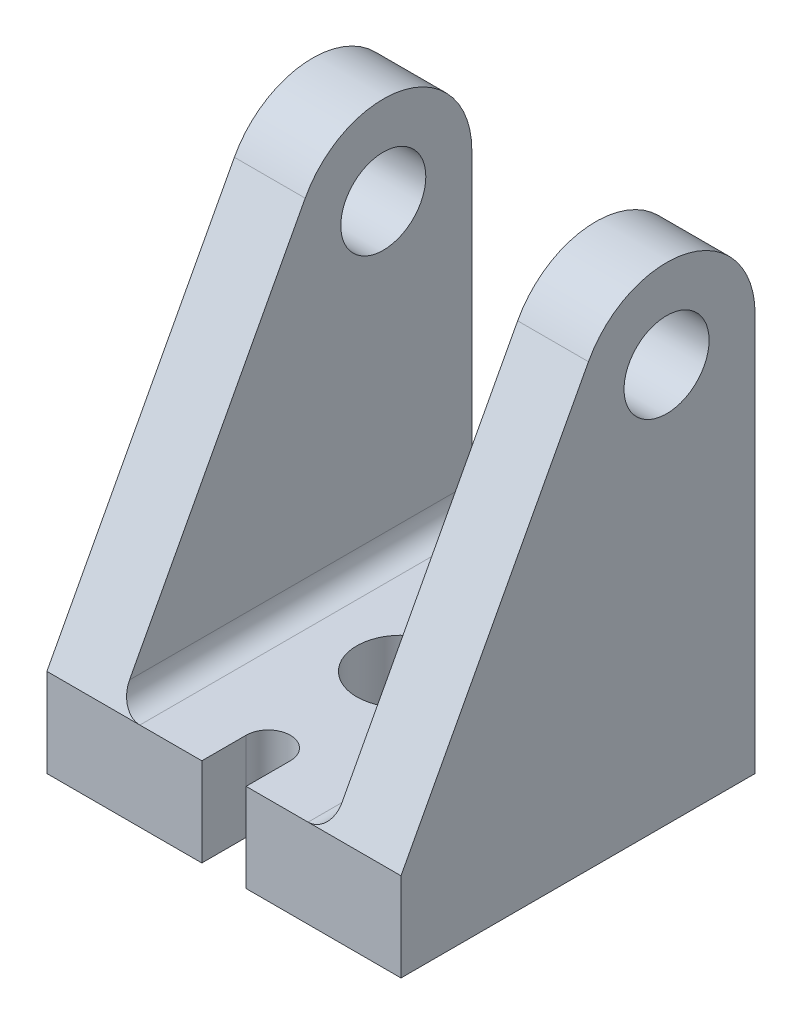
from build123d import *

# Parameters (mm, degrees)
SKETCH1_W           = 50.8
SKETCH1_H           = 50.8
BOSS_EXTRUDE1_DEPTH = 12.7
SKETCH2_R           = 6.1
BOSS_EXTRUDE2_DEPTH = 10.16
SKETCH3_R           = 6.35
CUT_EXTRUDE1_DEPTH  = 68.501425911
FILLET1_R           = 3.175


with BuildPart() as part:
    # Sketch1 → Boss-Extrude1 (new body)
    with BuildSketch(Plane(origin=(0, 0, 0), x_dir=(1, 0, 0), z_dir=(0, 1, 0))):
        Rectangle(SKETCH1_W, SKETCH1_H)
    extrude(amount=BOSS_EXTRUDE1_DEPTH)

    # Sketch2 → Boss-Extrude2 (add)
    with BuildSketch(Plane(origin=(25.4, 0, 0), x_dir=(0, 0, -1), z_dir=(1, 0, 0))):
        with BuildLine():
            Line((-25.4, 0), (-25.4, 12.7))
            Line((-25.4, 12.7), (1.494117647, 63.126470588))
            ThreePointArc((1.494117647, 63.126470588), (15.780202438, 69.470809752), (25.4, 57.15))
            Line((25.4, 57.15), (25.4, 0))
            Line((25.4, 0), (-25.4, 0))
        make_face()
        with Locations((12.7, 57.15)):
            Circle(SKETCH2_R, mode=Mode.SUBTRACT)
    boss_extrude2 = extrude(amount=-BOSS_EXTRUDE2_DEPTH)

    # Mirror1: Boss-Extrude2 across plane
    add(boss_extrude2.mirror(Plane(origin=(0, 0, 0), x_dir=(0, 0, 1), z_dir=(1, 0, 0))))

    # Sketch3 → Cut-Extrude1 (cut, through all)
    with BuildSketch(Plane(origin=(0, 12.7, 0), x_dir=(1, 0, 0), z_dir=(0, 1, 0))):
        with Locations(Location((0, 0, 0), (0, 0, 270))):
            Circle(SKETCH3_R)
        with BuildLine():
            Line((-3.175, -25.4), (-3.175, -19.05))
            ThreePointArc((-3.175, -19.05), (0, -15.875), (3.175, -19.05))
            Line((3.175, -19.05), (3.175, -25.4))
            Line((3.175, -25.4), (-3.175, -25.4))
        make_face()
    extrude(amount=-CUT_EXTRUDE1_DEPTH, mode=Mode.SUBTRACT)

    # Fillet1
    fillet1_edges = [part.edges().sort_by_distance(p)[0] for p in [
        (15.24, 12.7, 0),
        (-15.24, 12.7, 0),
    ]]
    fillet(fillet1_edges, radius=FILLET1_R)


solid = part.part
